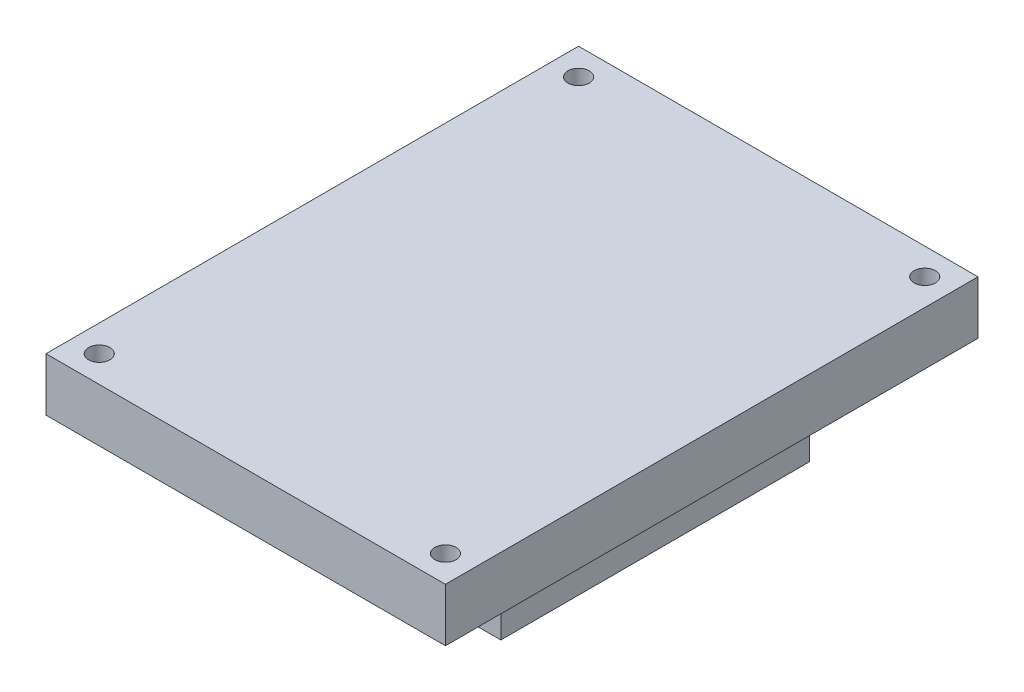
from build123d import *

# Parameters (mm, degrees)
SKETCH1_W           = 75
SKETCH1_H           = 100
BOSS_EXTRUDE1_DEPTH = 10
SKETCH2_W           = 30
SKETCH2_H           = 58
SKETCH2_W_2         = 20
SKETCH2_H_2         = 40.9
BOSS_EXTRUDE2_DEPTH = 26.76
SKETCH3_R           = 2
CUT_EXTRUDE1_DEPTH  = 3
SKETCH4_R           = 2
CUT_EXTRUDE2_DEPTH  = 23


with BuildPart() as part:
    # Sketch1 → Boss-Extrude1 (new body)
    with BuildSketch(Plane(origin=(0, 0, 0), x_dir=(1, 0, 0), z_dir=(0, 1, 0))):
        Rectangle(SKETCH1_W, SKETCH1_H)
    extrude(amount=BOSS_EXTRUDE1_DEPTH)

    # Sketch2 → Boss-Extrude2 (add)
    with BuildSketch(Plane.XZ):
        with Locations((0, -11.900165179)):
            Rectangle(SKETCH2_W, SKETCH2_H)
        with Locations((0, -11.900165179)):
            Rectangle(SKETCH2_W_2, SKETCH2_H_2, mode=Mode.SUBTRACT)
    extrude(amount=BOSS_EXTRUDE2_DEPTH)

    # Sketch3 → Cut-Extrude1 (cut)
    with BuildSketch(Plane.XZ.offset(26.76)):
        with Locations(Location((-5, 12.399834821, 0), (0, 0, 270))):
            Circle(SKETCH3_R)
        with Locations(Location((5, 12.399834821, 0), (0, 0, 270))):
            Circle(SKETCH3_R)
        with Locations(Location((5, -36.200165179, 0), (0, 0, 270))):
            Circle(SKETCH3_R)
        with Locations(Location((-5, -36.200165179, 0), (0, 0, 270))):
            Circle(SKETCH3_R)
    extrude(amount=-CUT_EXTRUDE1_DEPTH, mode=Mode.SUBTRACT)

    # Sketch4 → Cut-Extrude2 (cut)
    with BuildSketch(Plane.XZ):
        with Locations(Location((-32.5, -45, 0), (0, 0, 270))):
            Circle(SKETCH4_R)
        with Locations(Location((32.5, -45, 0), (0, 0, 90))):
            Circle(SKETCH4_R)
        with Locations(Location((32.5, 45, 0), (0, 0, 270))):
            Circle(SKETCH4_R)
        with Locations(Location((-32.5, 45, 0), (0, 0, 90))):
            Circle(SKETCH4_R)
    extrude(amount=-CUT_EXTRUDE2_DEPTH, mode=Mode.SUBTRACT)


solid = part.part
